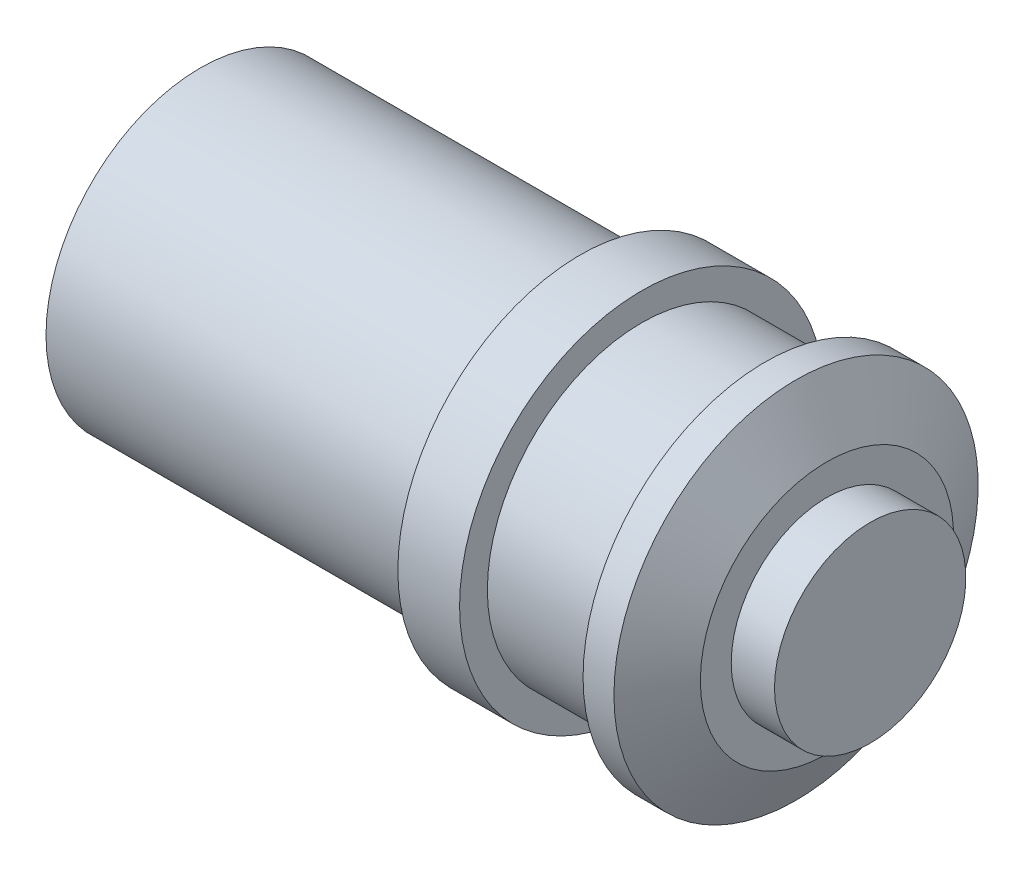
from build123d import *


with BuildPart() as part:
    # Sketch1 → Revolve1 (revolve)
    with BuildSketch(Plane(origin=(0, 0, 0), x_dir=(1, 0, 0), z_dir=(0, 1, 0)), mode=Mode.PRIVATE) as revolve1_sk:
        Polygon((21.7, 0), (21.7, 3.1), (20.298611111, 3.1), (20.298611111, 4.1), (19.298611111, 5.9), (18.298611111, 5.9), (18.298611111, 5), (14.298611111, 5), (14.298611111, 5.9), (12.298611111, 5.9), (12.298611111, 5), (0, 5), (0, 0), align=None)
    revolve(revolve1_sk.sketch.rotate(Axis((0, 0, 0), (1, 0, 0)), 180), axis=Axis((0, 0, 0), (1, 0, 0)))


solid = part.part
